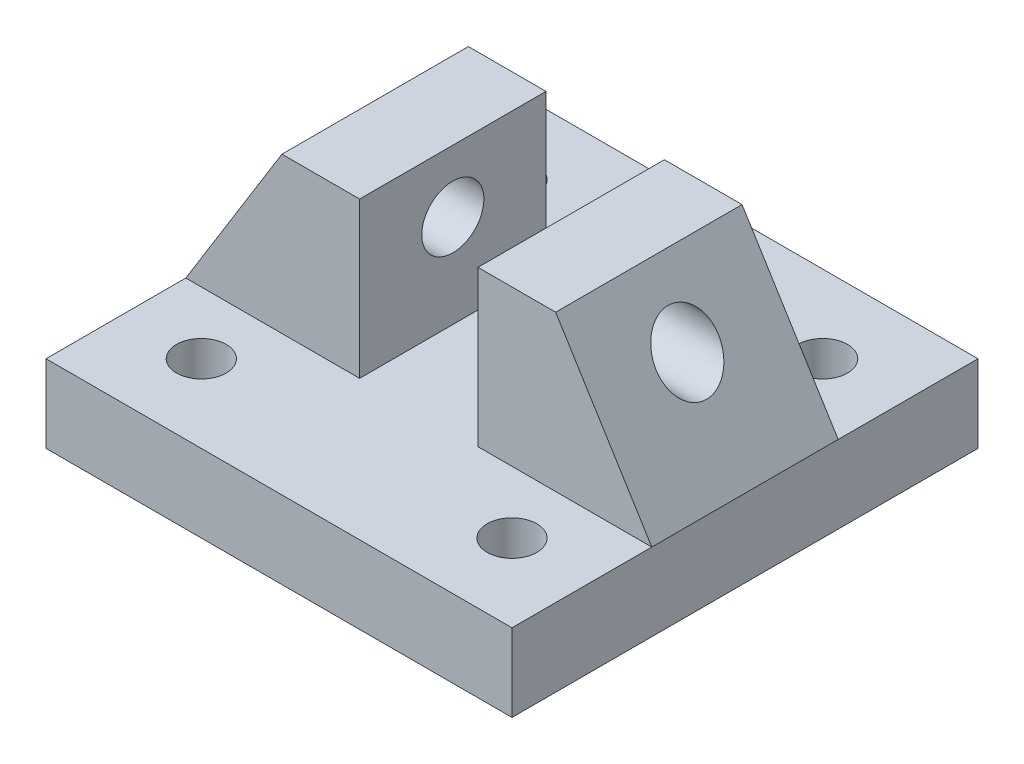
from build123d import *

# Parameters (mm, degrees)
SKETCH1_W                = 30
SKETCH1_H                = 30
BOSS_EXTRUDE1_DEPTH      = 5
BOSS_EXTRUDE2_DEPTH      = 6
BOSS_EXTRUDE2_DEPTH_BACK = 6
M3_CLEARANCE_HOLE1_D     = 3.2
CUT_EXTRUDE1_DEPTH       = 26.980762114
CUT_EXTRUDE1_DEPTH_BACK  = 8
SKETCH5_R                = 2


with BuildPart() as part:
    # Sketch1 → Boss-Extrude1 (new body)
    with BuildSketch(Plane(origin=(0, 0, 0), x_dir=(1, 0, 0), z_dir=(0, 1, 0))):
        Rectangle(SKETCH1_W, SKETCH1_H)
    extrude(amount=BOSS_EXTRUDE1_DEPTH)

    # Sketch2 → Boss-Extrude2 (add, two sides: drawn at the far end of the back side and taken through both)
    with BuildSketch(Plane.XY.offset(-BOSS_EXTRUDE2_DEPTH_BACK)):
        Polygon((15, 0), (-15, 0), (-15, 5), (-8.81, 15), (-3.81, 15), (-3.81, 5), (3.81, 5), (3.81, 15), (8.81, 15), (15, 5), align=None)
    extrude(amount=BOSS_EXTRUDE2_DEPTH + BOSS_EXTRUDE2_DEPTH_BACK)

    # M3 Clearance Hole1 (through all)
    with Locations(Plane(origin=(0, 5, 0), x_dir=(1, 0, 0), z_dir=(0, 1, 0))):
        with Locations((-10, 10), (10, 10), (10, -10), (-10, -10)):
            Hole(M3_CLEARANCE_HOLE1_D / 2)

    # Sketch5 → Cut-Extrude1 (cut, two sides: drawn at the far end of the back side and taken through both)
    with BuildSketch(Plane(origin=(0, 0, 0), x_dir=(0, 0, -1), z_dir=(1, 0, 0)).offset(-CUT_EXTRUDE1_DEPTH_BACK)):
        with Locations(Location((0, 11, 0), (0, 0, 270))):
            Circle(SKETCH5_R)
    extrude(amount=CUT_EXTRUDE1_DEPTH + CUT_EXTRUDE1_DEPTH_BACK, mode=Mode.SUBTRACT)


solid = part.part
